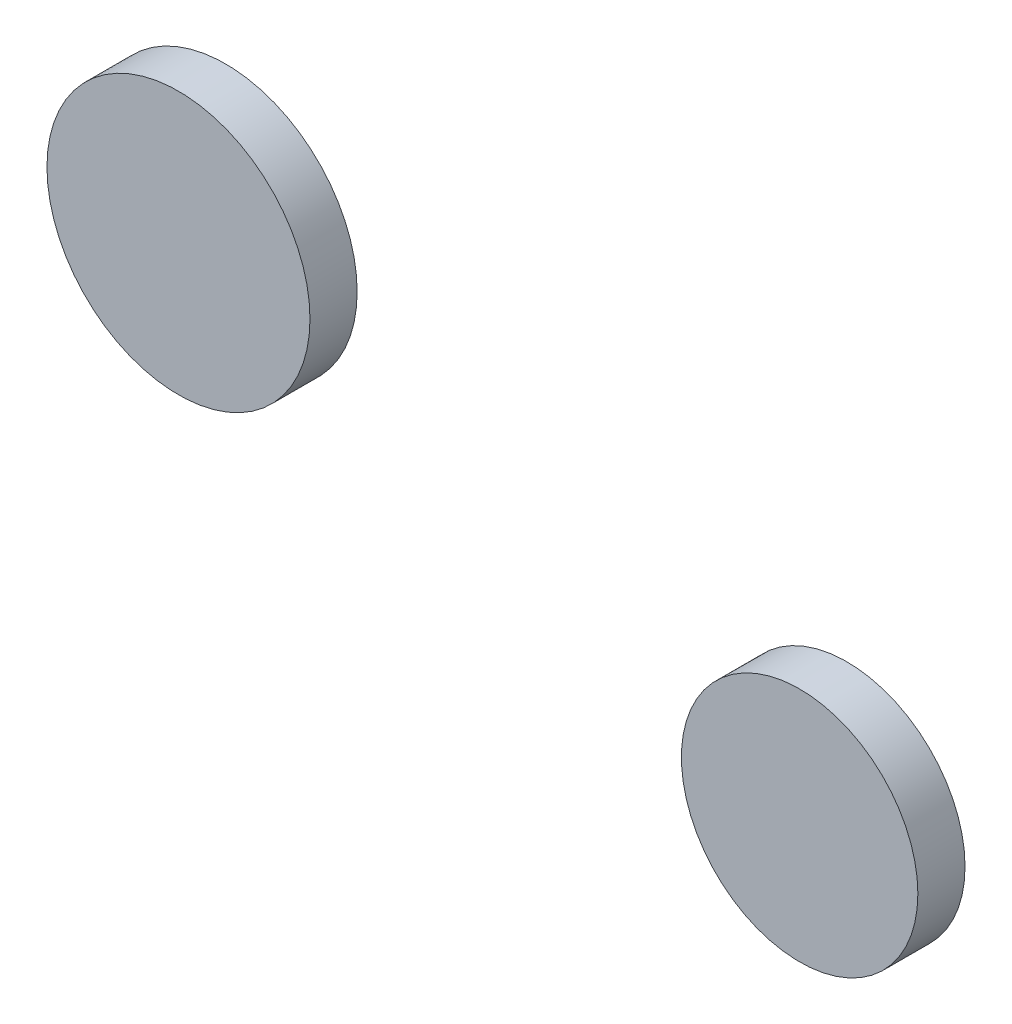
from build123d import *

# Parameters (mm, degrees)
SKETCH_1_R        = 25.068719059
EXTRUDE_1_DEPTH   = 10
SKETCH_1_R_2      = 27.882952622
EXTRUDE_1_2_DEPTH = 10


with BuildPart() as part:
    # 草图1 → 凸台-拉伸1 (new body)
    with BuildSketch(Plane.XY):
        with Locations((-54.368999484, 10.847017139)):
            Circle(SKETCH_1_R)
    extrude(amount=EXTRUDE_1_DEPTH)


with BuildPart() as body_2:
    # 草图1 → Extrude 1 2 (new body)
    with BuildSketch(Plane.XY):
        with Locations((-186.065711788, 51.948818312)):
            Circle(SKETCH_1_R_2)
    extrude(amount=EXTRUDE_1_2_DEPTH)


solid = Compound([part.part, body_2.part])
